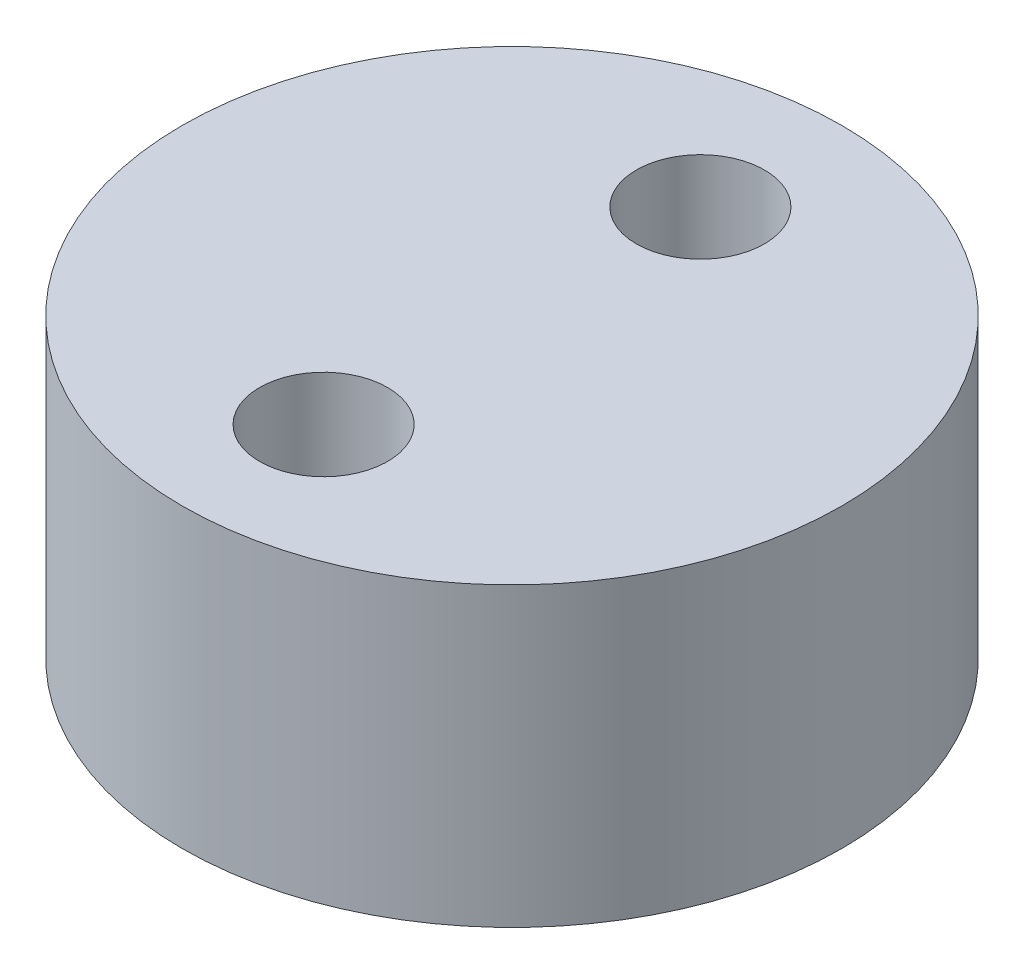
from build123d import *

# Parameters (mm, degrees)
SKETCH1_R           = 11.1125
SKETCH1_R_2         = 2.159
BOSS_EXTRUDE1_DEPTH = 10


with BuildPart() as part:
    # Sketch1 → Boss-Extrude1 (new body)
    with BuildSketch(Plane(origin=(0, 0, 0), x_dir=(1, 0, 0), z_dir=(0, 1, 0))):
        with Locations(Location((0, 0, 0), (0, 0, 270))):
            Circle(SKETCH1_R)
        with Locations(Location((0, 6.35, 0), (0, 0, 270))):
            Circle(SKETCH1_R_2, mode=Mode.SUBTRACT)
        with Locations(Location((0, -6.35, 0), (0, 0, 90))):
            Circle(SKETCH1_R_2, mode=Mode.SUBTRACT)
    extrude(amount=BOSS_EXTRUDE1_DEPTH)


solid = part.part
